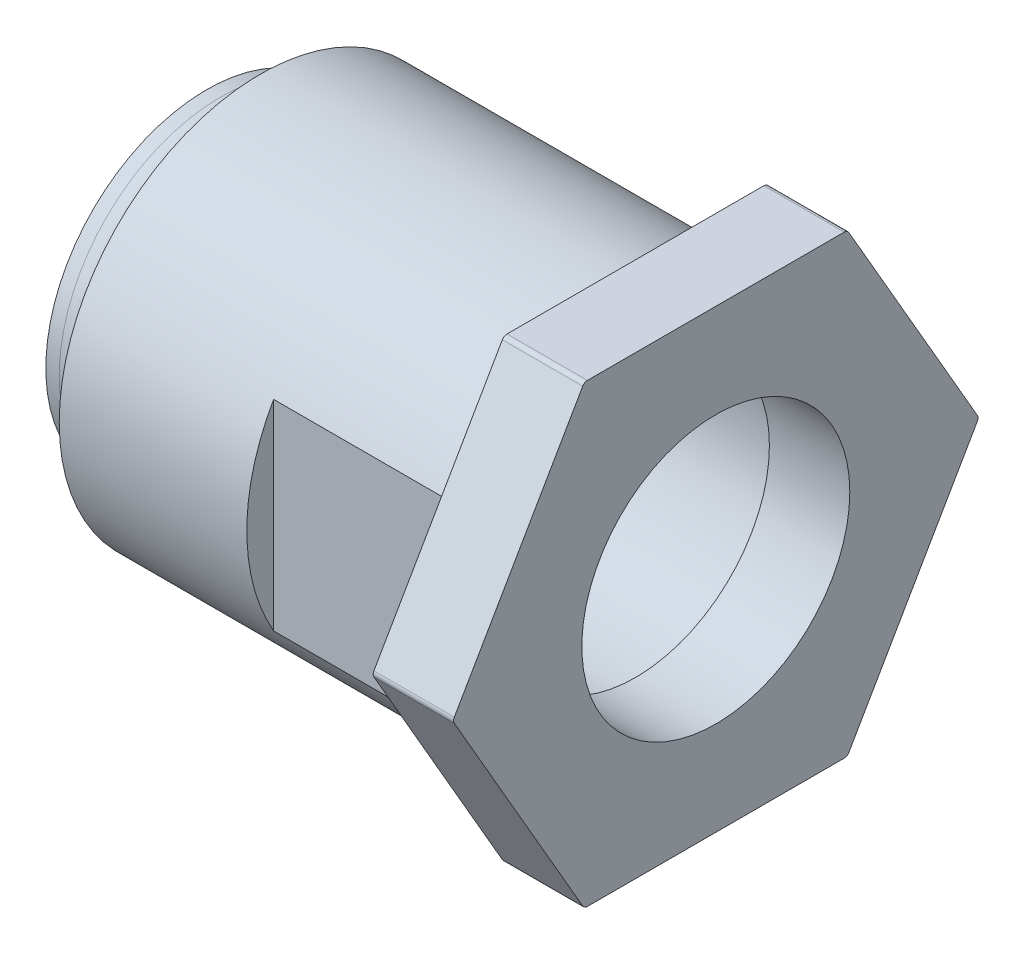
from build123d import *

# Parameters (mm, degrees)
SKETCH2_OUTSIDE_W   = 22.314
SKETCH2_OUTSIDE_H   = 22.314
SKETCH2_OUTSIDE_W_2 = 13
SKETCH2_OUTSIDE_H_2 = 17
CUT_EXTRUDE1_DEPTH  = 7
SKETCH3_R           = 5
BOSS_EXTRUDE1_DEPTH = 3
FILLET1_R           = 0.2


with BuildPart() as part:
    # Sketch1 → Revolve1 (revolve)
    with BuildSketch(Plane.XY, mode=Mode.PRIVATE) as revolve1_sk:
        with BuildLine():
            Line((0, 5.5), (-16, 5.5))
            Line((-16, 5.5), (-16, 6))
            Line((-16, 6), (-15.5, 6))
            ThreePointArc((-15.5, 6), (-14.439339828, 6.439339828), (-14, 7.5))
            Line((-14, 7.5), (0, 7.5))
            Line((0, 7.5), (0, 5.5))
        make_face()
    revolve(revolve1_sk.sketch.rotate(Axis((0, 0, 0), (-1, 0, 0)), 90), axis=Axis((0, 0, 0), (-1, 0, 0)))

    # Sketch2 outside → Cut-Extrude1 (cut)
    with BuildSketch(Plane(origin=(0, 0, 0), x_dir=(0, 0, -1), z_dir=(1, 0, 0))):
        Rectangle(SKETCH2_OUTSIDE_W, SKETCH2_OUTSIDE_H)
        Rectangle(SKETCH2_OUTSIDE_W_2, SKETCH2_OUTSIDE_H_2, mode=Mode.SUBTRACT)
    extrude(amount=-CUT_EXTRUDE1_DEPTH, mode=Mode.SUBTRACT)

    # Sketch3 → Boss-Extrude1 (add)
    with BuildSketch(Plane(origin=(0, 0, 0), x_dir=(0, 0, -1), z_dir=(1, 0, 0))):
        Polygon((9.814954576, 0), (4.907477288, 8.5), (-4.907477288, 8.5), (-9.814954576, 0), (-4.907477288, -8.5), (4.907477288, -8.5), align=None)
        Circle(SKETCH3_R, mode=Mode.SUBTRACT)
    extrude(amount=BOSS_EXTRUDE1_DEPTH)

    # Fillet1
    fillet1_edges = [part.edges().sort_by_distance(p)[0] for p in [
        (1.5, -8.5, -4.907477288),
        (1.5, 0, -9.814954576),
        (1.5, 8.5, -4.907477288),
        (1.5, 8.5, 4.907477288),
        (1.5, 0, 9.814954576),
        (1.5, -8.5, 4.907477288),
    ]]
    fillet(fillet1_edges, radius=FILLET1_R)


solid = part.part
